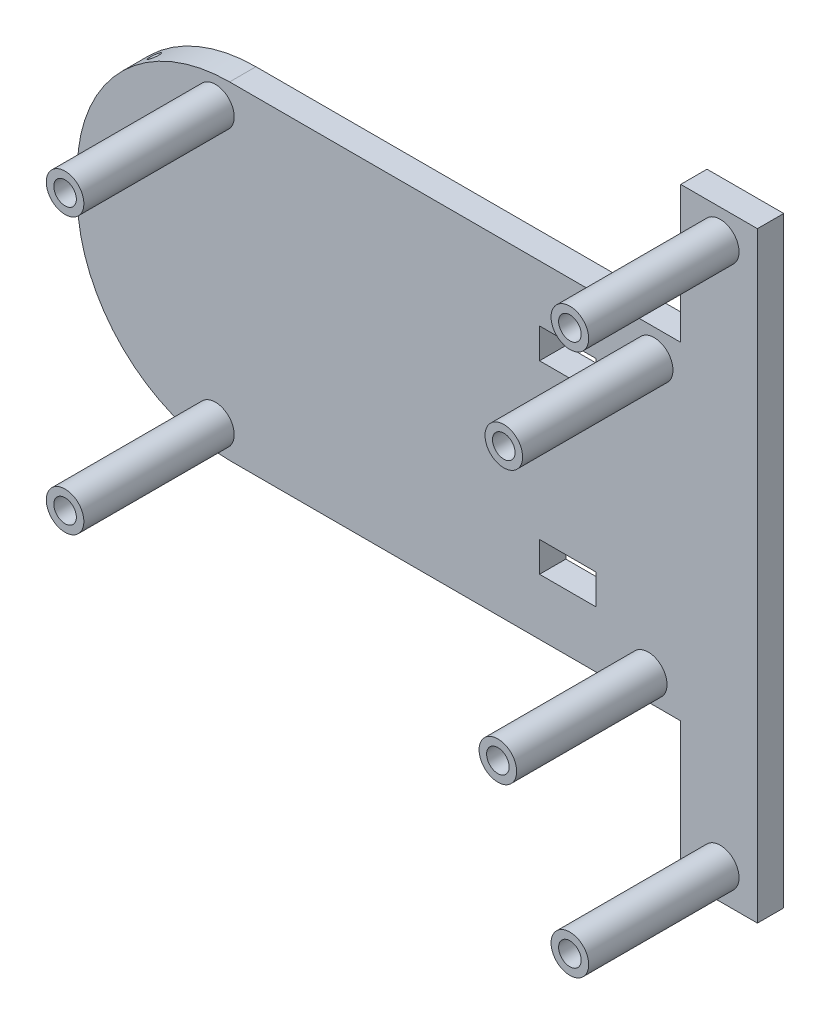
from build123d import *

# Parameters (mm, degrees)
ESQUISSE1_W             = 15.04863884
ESQUISSE1_H             = 8.025940715
BOSS_EXTRU_2_DEPTH      = 7
ESQUISSE2_R             = 1.5
ENL_V_MAT_EXTRU_1_DEPTH = 22
ESQUISSE7_R             = 1.5
ENL_V_MAT_EXTRU_2_DEPTH = 22
ESQUISSE8_R             = 5
ESQUISSE8_R_2           = 3
BOSS_EXTRU_3_DEPTH      = 40


with BuildPart() as part:
    # Esquisse1 → Boss.-Extru.2 (new body)
    with BuildSketch(Plane.XY):
        with BuildLine():
            Line((-20.404811956, 60.852158428), (-20.404811956, 43.608028339))
            Line((-20.404811956, 43.608028339), (-140.404811956, 43.608028339))
            ThreePointArc((-140.404811956, 43.608028339), (-170.122450923, 30.625328971), (-180.789117416, 0))
            ThreePointArc((-180.789117416, 0), (-170.122450923, -30.625328971), (-140.404811956, -43.608028339))
            Line((-140.404811956, -43.608028339), (-20.404811956, -43.608028339))
            Line((-20.404811956, -43.608028339), (-20.404811956, -60.852158428))
            Line((-20.404811956, -60.852158428), (-20.404811956, -80))
            Line((-20.404811956, -80), (0, -80))
            Line((0, -80), (0, 80))
            Line((0, 80), (-20.404811956, 80))
            Line((-20.404811956, 80), (-20.404811956, 60.852158428))
        make_face()
        with Locations((-50.437129359, 24.595057981)):
            Rectangle(ESQUISSE1_W, ESQUISSE1_H, mode=Mode.SUBTRACT)
        with Locations((-50.437129359, -24.595057981)):
            Rectangle(ESQUISSE1_W, ESQUISSE1_H, mode=Mode.SUBTRACT)
    extrude(amount=BOSS_EXTRU_2_DEPTH)

    # Esquisse2 → Enlèv. mat.-Extru.1 (cut)
    with BuildSketch(Plane(origin=(-170.122450923, 30.625328971, 0), x_dir=(0, 0, 1), z_dir=(-0.7337061397658711, 0.6794669237496878, 0))):
        with Locations(Location((3.566685756, 8.282361033, 0), (0, 0, 270))):
            Circle(ESQUISSE2_R)
        with Locations(Location((3.566685756, -21.717638967, 0), (0, 0, 270))):
            Circle(ESQUISSE2_R)
        with Locations(Location((3.566685756, -11.717638967, 0), (0, 0, 270))):
            Circle(ESQUISSE2_R)
    extrude(amount=-ENL_V_MAT_EXTRU_1_DEPTH, mode=Mode.SUBTRACT)

    # Esquisse7 → Enlèv. mat.-Extru.2 (cut)
    with BuildSketch(Plane(origin=(-170.122450923, -30.625328971, 7), x_dir=(0, 0, 1), z_dir=(-0.7337061397658707, -0.6794669237496883, 0))):
        with Locations(Location((-3.481934061, 21.717638967, 0), (0, 0, 270))):
            Circle(ESQUISSE7_R)
        with Locations(Location((-3.481934061, -8.282361033, 0), (0, 0, 270))):
            Circle(ESQUISSE7_R)
        with Locations(Location((-3.481934061, 11.717638967, 0), (0, 0, 270))):
            Circle(ESQUISSE7_R)
    extrude(amount=-ENL_V_MAT_EXTRU_2_DEPTH, mode=Mode.SUBTRACT)

    # Esquisse8 → Boss.-Extru.3 (add)
    # profile 1 of 6: a face of its own
    with BuildSketch(Plane.XY.offset(7)):
        with Locations(Location((-9.890580264, 72.213588888, 0), (0, 0, 180))):
            Circle(ESQUISSE8_R)
        with Locations((-9.890580264, 72.213588888)):
            Circle(ESQUISSE8_R_2, mode=Mode.SUBTRACT)
    # profile 2 of 6: a face of its own
    with BuildSketch(Plane.XY.offset(7)):
        with Locations(Location((-9.890580264, -71.991912234, 0), (0, 0, 180))):
            Circle(ESQUISSE8_R)
        with Locations((-9.890580264, -71.991912234)):
            Circle(ESQUISSE8_R_2, mode=Mode.SUBTRACT)
    # profile 3 of 6: a face of its own
    with BuildSketch(Plane.XY.offset(7)):
        with Locations(Location((-27.465625713, 36.162213608, 0), (0, 0, 180))):
            Circle(ESQUISSE8_R)
        with Locations((-27.465625713, 36.162213608)):
            Circle(ESQUISSE8_R_2, mode=Mode.SUBTRACT)
    # profile 4 of 6: a face of its own
    with BuildSketch(Plane.XY.offset(7)):
        with Locations(Location((-29.042873382, -37.067142431, 0), (0, 0, 180))):
            Circle(ESQUISSE8_R)
        with Locations((-29.042873382, -37.067142431)):
            Circle(ESQUISSE8_R_2, mode=Mode.SUBTRACT)
    # profile 5 of 6: a face of its own
    with BuildSketch(Plane.XY.offset(7)):
        with Locations(Location((-144.181953183, 36.162213608, 0), (0, 0, 180))):
            Circle(ESQUISSE8_R)
        with Locations((-144.181953183, 36.162213608)):
            Circle(ESQUISSE8_R_2, mode=Mode.SUBTRACT)
    # profile 6 of 6: a face of its own
    with BuildSketch(Plane.XY.offset(7)):
        with Locations(Location((-144.181953183, -37.067142431, 0), (0, 0, 180))):
            Circle(ESQUISSE8_R)
        with Locations((-144.181953183, -37.067142431)):
            Circle(ESQUISSE8_R_2, mode=Mode.SUBTRACT)
    extrude(amount=BOSS_EXTRU_3_DEPTH)


solid = part.part
